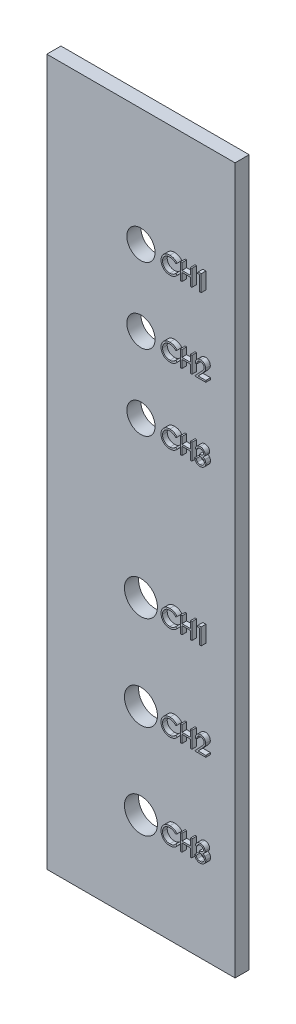
from build123d import *

# Parameters (mm, degrees)
SKETCH1_W           = 40
SKETCH1_H           = 150
SKETCH1_R           = 3
SKETCH1_R_2         = 3.5
BOSS_EXTRUDE1_DEPTH = 3
BOSS_EXTRUDE2_DEPTH = 1


with BuildPart() as part:
    # Sketch1 → Boss-Extrude1 (new body)
    with BuildSketch(Plane.XY):
        Rectangle(SKETCH1_W, SKETCH1_H)
        with Locations((0, 34)):
            Circle(SKETCH1_R, mode=Mode.SUBTRACT)
        with Locations((0, 50)):
            Circle(SKETCH1_R, mode=Mode.SUBTRACT)
        with Locations((0, 18)):
            Circle(SKETCH1_R, mode=Mode.SUBTRACT)
        with Locations((0, -55)):
            Circle(SKETCH1_R_2, mode=Mode.SUBTRACT)
        with Locations((0, -35)):
            Circle(SKETCH1_R_2, mode=Mode.SUBTRACT)
        with Locations((0, -15)):
            Circle(SKETCH1_R_2, mode=Mode.SUBTRACT)
    extrude(amount=BOSS_EXTRUDE1_DEPTH)

    # Sketch2 → Boss-Extrude2 (add)
    with BuildSketch(Plane.XY.offset(3)):
        with BuildLine():
            Line((8.679487179, 51.357772436), (8.404647436, 51.147435897))
            add(Edge.make_bspline(
                [(8.404647436, 51.147435897), (8.385041548, 51.170801867), (8.346094101, 51.217218783), (8.283434898, 51.282398327), (8.218133255, 51.343463589), (8.150214134, 51.400705469), (8.078455015, 51.452122234), (8.004594216, 51.500393337), (7.927396171, 51.543661075), (7.820644436, 51.596124061), (7.680996588, 51.650870216), (7.505201749, 51.696773448), (7.32169065, 51.725994623), (7.196493051, 51.729159465), (7.1328125, 51.730769231)],
                knots=[0, 0, 0, 0, 0.757959112, 1.505699292, 2.245454638, 2.979532153, 3.711538275, 4.438200793, 5.171680507, 5.909471876, 7.393775596, 8.890124382, 10.418191784, 12, 12, 12, 12], degree=3))
            add(Edge.make_bspline(
                [(7.1328125, 51.730769231), (7.097729201, 51.730365268), (7.027888208, 51.729561092), (6.924239735, 51.718951967), (6.822526683, 51.704040757), (6.722815217, 51.681915434), (6.625232259, 51.653942815), (6.529139857, 51.620517401), (6.435929257, 51.579162561), (6.344311019, 51.533454301), (6.256531808, 51.481826856), (6.17347676, 51.425513504), (6.095448792, 51.365144408), (6.02238618, 51.300493302), (5.954214231, 51.231851341), (5.891426921, 51.158487), (5.83424151, 51.080634826), (5.781524485, 50.999321419), (5.734311752, 50.914783627), (5.694781873, 50.826708556), (5.65977675, 50.736604453), (5.632077508, 50.643453293), (5.610152991, 50.547910527), (5.595025328, 50.449719739), (5.584536856, 50.349086059), (5.58373668, 50.280876747), (5.583333333, 50.246494391)],
                knots=[0, 0, 0, 0, 1.054917814, 2.100044995, 3.131103042, 4.146048494, 5.169673617, 6.183595914, 7.203665975, 8.234915748, 9.262203917, 10.264457458, 11.251630812, 12.227803204, 13.197192746, 14.159520551, 15.12972552, 16.100847026, 17.073214652, 18.039054194, 19.002613845, 19.979014051, 20.95965708, 21.949030935, 22.966165397, 24, 24, 24, 24], degree=3))
            add(Edge.make_bspline(
                [(5.583333333, 50.246494391), (5.584595152, 50.194763071), (5.587072567, 50.093195486), (5.609120901, 49.944424876), (5.642625992, 49.801904202), (5.692841569, 49.66652436), (5.75476062, 49.536616002), (5.833001231, 49.414377148), (5.923617768, 49.297960584), (6.027892188, 49.190117636), (6.142298004, 49.091603911), (6.265045915, 49.004853329), (6.395830203, 48.932538447), (6.533206833, 48.8723625), (6.678232947, 48.826105772), (6.83064775, 48.793541649), (6.990119745, 48.772299468), (7.099089145, 48.77026578), (7.154547276, 48.769230769)],
                knots=[0, 0, 0, 0, 1.029171465, 2.020641659, 2.987623507, 3.938342917, 4.889210282, 5.84687017, 6.821220943, 7.821438502, 8.827599549, 9.822697543, 10.807740252, 11.797342354, 12.80366471, 13.83203677, 14.896651826, 16, 16, 16, 16], degree=3))
            add(Edge.make_bspline(
                [(7.154547276, 48.769230769), (7.215649965, 48.770919549), (7.335914674, 48.774243472), (7.5122827, 48.802402721), (7.681118466, 48.848060638), (7.842431052, 48.911958561), (7.995765698, 48.995023849), (8.141362359, 49.095721726), (8.279343929, 49.215010059), (8.362315211, 49.306093187), (8.404647436, 49.352564103)],
                knots=[0, 0, 0, 0, 1.028121516, 2.023589091, 2.998037872, 3.967518031, 4.937445131, 5.927275754, 6.942489185, 8, 8, 8, 8], degree=3))
            Line((8.404647436, 49.352564103), (8.679487179, 49.144330929))
            add(Edge.make_bspline(
                [(8.679487179, 49.144330929), (8.65736907, 49.115792478), (8.613238794, 49.058852271), (8.541780777, 48.978580562), (8.46650348, 48.903076526), (8.38684777, 48.832948905), (8.303729978, 48.766794439), (8.215657666, 48.706492608), (8.123788634, 48.651201724), (8.028434155, 48.600574799), (7.929695542, 48.555657552), (7.827691107, 48.517203784), (7.722860531, 48.484078895), (7.615199023, 48.456826958), (7.504483266, 48.435555874), (7.391112792, 48.421336199), (7.274842917, 48.411594285), (7.196401496, 48.410706369), (7.156650641, 48.41025641)],
                knots=[0, 0, 0, 0, 0.986787822, 1.968848986, 2.935600012, 3.899624008, 4.868462664, 5.837806735, 6.815139263, 7.798259679, 8.787526145, 9.778297419, 10.776456485, 11.791383307, 12.812564526, 13.85620153, 14.913611965, 16, 16, 16, 16], degree=3))
            add(Edge.make_bspline(
                [(7.156650641, 48.41025641), (7.119006974, 48.410518403), (7.044571284, 48.411036461), (6.934672532, 48.419428628), (6.827682951, 48.430878365), (6.723908326, 48.448118496), (6.622782351, 48.468462836), (6.525221766, 48.495734093), (6.430266556, 48.526283259), (6.338298215, 48.562188246), (6.249238515, 48.602704429), (6.163374704, 48.648495987), (6.080746271, 48.699177852), (6.000540851, 48.753632863), (5.923943267, 48.813610164), (5.850289742, 48.878276799), (5.779167265, 48.94741481), (5.73516458, 48.997269663), (5.713040865, 49.022335737)],
                knots=[0, 0, 0, 0, 1.114604814, 2.203992996, 3.262667896, 4.300477797, 5.318619304, 6.316056647, 7.298880507, 8.271930387, 9.238335007, 10.195173496, 11.151986948, 12.108099108, 13.064862484, 14.031167946, 15.010108607, 16, 16, 16, 16], degree=3))
            add(Edge.make_bspline(
                [(5.713040865, 49.022335737), (5.677605222, 49.065876926), (5.607161745, 49.152433637), (5.517036062, 49.292719618), (5.439888506, 49.439187827), (5.377512586, 49.592607755), (5.328749852, 49.752635143), (5.294968657, 49.919350657), (5.273017053, 50.092598599), (5.270506764, 50.210435388), (5.269230769, 50.270332532)],
                knots=[0, 0, 0, 0, 0.994628077, 1.977248131, 2.950237994, 3.925870899, 4.908910175, 5.911660606, 6.938484602, 8, 8, 8, 8], degree=3))
            add(Edge.make_bspline(
                [(5.269230769, 50.270332532), (5.270785963, 50.333287986), (5.273845709, 50.45714891), (5.299841504, 50.638922863), (5.341660301, 50.813074262), (5.401057189, 50.979278007), (5.476362541, 51.138408287), (5.569389154, 51.289249492), (5.679056297, 51.432766292), (5.804503864, 51.566781043), (5.9420712, 51.689320396), (6.089390014, 51.797126599), (6.24617196, 51.886844115), (6.410689812, 51.961840278), (6.584175494, 52.019484741), (6.766258863, 52.059837928), (6.956597778, 52.084955044), (7.086460203, 52.088130252), (7.15244391, 52.08974359)],
                knots=[0, 0, 0, 0, 1.032925535, 2.032216505, 3.007276963, 3.968222605, 4.92396291, 5.891752235, 6.871517503, 7.883894988, 8.900124299, 9.891468569, 10.874487609, 11.85992873, 12.854644235, 13.869047385, 14.917252991, 16, 16, 16, 16], degree=3))
            add(Edge.make_bspline(
                [(7.15244391, 52.08974359), (7.192658382, 52.089261452), (7.272258879, 52.088307108), (7.390011532, 52.079000965), (7.504653859, 52.063487359), (7.616264841, 52.042371289), (7.725387457, 52.016163968), (7.831187698, 51.98202367), (7.934286385, 51.942987138), (8.034033293, 51.898028672), (8.129949843, 51.847561931), (8.222006162, 51.792146307), (8.30947102, 51.731850502), (8.392959869, 51.667187326), (8.47107608, 51.596788767), (8.546037558, 51.522591171), (8.615298637, 51.442457347), (8.658051832, 51.386052413), (8.679487179, 51.357772436)],
                knots=[0, 0, 0, 0, 1.096760587, 2.17092713, 3.219439832, 4.250915756, 5.268269357, 6.278326846, 7.281116186, 8.274029601, 9.260640565, 10.235837813, 11.203064059, 12.156899882, 13.114053108, 14.069676657, 15.032185724, 16, 16, 16, 16], degree=3))
        make_face()
        Polygon((9.397435897, 52), (9.711538462, 52), (9.711538462, 50.564102564), (11.506410256, 50.564102564), (11.506410256, 52), (11.820512821, 52), (11.820512821, 48.5), (11.506410256, 48.5), (11.506410256, 50.205128205), (9.711538462, 50.205128205), (9.711538462, 48.5), (9.397435897, 48.5), align=None)
        Polygon((13.147736378, 52), (13.794871795, 52), (13.794871795, 48.5), (13.480769231, 48.5), (13.480769231, 51.641025641), (12.942307692, 51.641025641), align=None)
        with BuildLine():
            Line((8.679487179, 35.357772436), (8.404647436, 35.147435897))
            add(Edge.make_bspline(
                [(8.404647436, 35.147435897), (8.385041548, 35.170801867), (8.346094101, 35.217218783), (8.283434898, 35.282398327), (8.218133255, 35.343463589), (8.150214134, 35.400705469), (8.078455015, 35.452122234), (8.004594216, 35.500393337), (7.927396171, 35.543661075), (7.820644436, 35.596124061), (7.680996588, 35.650870216), (7.505201749, 35.696773448), (7.32169065, 35.725994623), (7.196493051, 35.729159465), (7.1328125, 35.730769231)],
                knots=[0, 0, 0, 0, 0.757959112, 1.505699292, 2.245454638, 2.979532153, 3.711538275, 4.438200793, 5.171680507, 5.909471876, 7.393775596, 8.890124382, 10.418191784, 12, 12, 12, 12], degree=3))
            add(Edge.make_bspline(
                [(7.1328125, 35.730769231), (7.097729201, 35.730365268), (7.027888208, 35.729561092), (6.924239735, 35.718951967), (6.822526683, 35.704040757), (6.722815217, 35.681915434), (6.625232259, 35.653942815), (6.529139857, 35.620517401), (6.435929257, 35.579162561), (6.344311019, 35.533454301), (6.256531808, 35.481826856), (6.17347676, 35.425513504), (6.095448792, 35.365144408), (6.02238618, 35.300493302), (5.954214231, 35.231851341), (5.891426921, 35.158487), (5.83424151, 35.080634826), (5.781524485, 34.999321419), (5.734311752, 34.914783627), (5.694781873, 34.826708556), (5.65977675, 34.736604453), (5.632077508, 34.643453293), (5.610152991, 34.547910527), (5.595025328, 34.449719739), (5.584536856, 34.349086059), (5.58373668, 34.280876747), (5.583333333, 34.246494391)],
                knots=[0, 0, 0, 0, 1.054917814, 2.100044995, 3.131103042, 4.146048494, 5.169673617, 6.183595914, 7.203665975, 8.234915748, 9.262203917, 10.264457458, 11.251630812, 12.227803204, 13.197192746, 14.159520551, 15.12972552, 16.100847026, 17.073214652, 18.039054194, 19.002613845, 19.979014051, 20.95965708, 21.949030935, 22.966165397, 24, 24, 24, 24], degree=3))
            add(Edge.make_bspline(
                [(5.583333333, 34.246494391), (5.584595152, 34.194763071), (5.587072567, 34.093195486), (5.609120901, 33.944424876), (5.642625992, 33.801904202), (5.692841569, 33.66652436), (5.75476062, 33.536616002), (5.833001231, 33.414377148), (5.923617768, 33.297960584), (6.027892188, 33.190117636), (6.142298004, 33.091603911), (6.265045915, 33.004853329), (6.395830203, 32.932538447), (6.533206833, 32.8723625), (6.678232947, 32.826105772), (6.83064775, 32.793541649), (6.990119745, 32.772299468), (7.099089145, 32.77026578), (7.154547276, 32.769230769)],
                knots=[0, 0, 0, 0, 1.029171465, 2.020641659, 2.987623507, 3.938342917, 4.889210282, 5.84687017, 6.821220943, 7.821438502, 8.827599549, 9.822697543, 10.807740252, 11.797342354, 12.80366471, 13.83203677, 14.896651826, 16, 16, 16, 16], degree=3))
            add(Edge.make_bspline(
                [(7.154547276, 32.769230769), (7.215649965, 32.770919549), (7.335914674, 32.774243472), (7.5122827, 32.802402721), (7.681118466, 32.848060638), (7.842431052, 32.911958561), (7.995765698, 32.995023849), (8.141362359, 33.095721726), (8.279343929, 33.215010059), (8.362315211, 33.306093187), (8.404647436, 33.352564103)],
                knots=[0, 0, 0, 0, 1.028121516, 2.023589091, 2.998037872, 3.967518031, 4.937445131, 5.927275754, 6.942489185, 8, 8, 8, 8], degree=3))
            Line((8.404647436, 33.352564103), (8.679487179, 33.144330929))
            add(Edge.make_bspline(
                [(8.679487179, 33.144330929), (8.65736907, 33.115792478), (8.613238794, 33.058852271), (8.541780777, 32.978580562), (8.46650348, 32.903076526), (8.38684777, 32.832948905), (8.303729978, 32.766794439), (8.215657666, 32.706492608), (8.123788634, 32.651201724), (8.028434155, 32.600574799), (7.929695542, 32.555657552), (7.827691107, 32.517203784), (7.722860531, 32.484078895), (7.615199023, 32.456826958), (7.504483266, 32.435555874), (7.391112792, 32.421336199), (7.274842917, 32.411594285), (7.196401496, 32.410706369), (7.156650641, 32.41025641)],
                knots=[0, 0, 0, 0, 0.986787822, 1.968848986, 2.935600012, 3.899624008, 4.868462664, 5.837806735, 6.815139263, 7.798259679, 8.787526145, 9.778297419, 10.776456485, 11.791383307, 12.812564526, 13.85620153, 14.913611965, 16, 16, 16, 16], degree=3))
            add(Edge.make_bspline(
                [(7.156650641, 32.41025641), (7.119006974, 32.410518403), (7.044571284, 32.411036461), (6.934672532, 32.419428628), (6.827682951, 32.430878365), (6.723908326, 32.448118496), (6.622782351, 32.468462836), (6.525221766, 32.495734093), (6.430266556, 32.526283259), (6.338298215, 32.562188246), (6.249238515, 32.602704429), (6.163374704, 32.648495987), (6.080746271, 32.699177852), (6.000540851, 32.753632863), (5.923943267, 32.813610164), (5.850289742, 32.878276799), (5.779167265, 32.94741481), (5.73516458, 32.997269663), (5.713040865, 33.022335737)],
                knots=[0, 0, 0, 0, 1.114604814, 2.203992996, 3.262667896, 4.300477797, 5.318619304, 6.316056647, 7.298880507, 8.271930387, 9.238335007, 10.195173496, 11.151986948, 12.108099108, 13.064862484, 14.031167946, 15.010108607, 16, 16, 16, 16], degree=3))
            add(Edge.make_bspline(
                [(5.713040865, 33.022335737), (5.677605222, 33.065876926), (5.607161745, 33.152433637), (5.517036062, 33.292719618), (5.439888506, 33.439187827), (5.377512586, 33.592607755), (5.328749852, 33.752635143), (5.294968657, 33.919350657), (5.273017053, 34.092598599), (5.270506764, 34.210435388), (5.269230769, 34.270332532)],
                knots=[0, 0, 0, 0, 0.994628077, 1.977248131, 2.950237994, 3.925870899, 4.908910175, 5.911660606, 6.938484602, 8, 8, 8, 8], degree=3))
            add(Edge.make_bspline(
                [(5.269230769, 34.270332532), (5.270785963, 34.333287986), (5.273845709, 34.45714891), (5.299841504, 34.638922863), (5.341660301, 34.813074262), (5.401057189, 34.979278007), (5.476362541, 35.138408287), (5.569389154, 35.289249492), (5.679056297, 35.432766292), (5.804503864, 35.566781043), (5.9420712, 35.689320396), (6.089390014, 35.797126599), (6.24617196, 35.886844115), (6.410689812, 35.961840278), (6.584175494, 36.019484741), (6.766258863, 36.059837928), (6.956597778, 36.084955044), (7.086460203, 36.088130252), (7.15244391, 36.08974359)],
                knots=[0, 0, 0, 0, 1.032925535, 2.032216505, 3.007276963, 3.968222605, 4.92396291, 5.891752235, 6.871517503, 7.883894988, 8.900124299, 9.891468569, 10.874487609, 11.85992873, 12.854644235, 13.869047385, 14.917252991, 16, 16, 16, 16], degree=3))
            add(Edge.make_bspline(
                [(7.15244391, 36.08974359), (7.192658382, 36.089261452), (7.272258879, 36.088307108), (7.390011532, 36.079000965), (7.504653859, 36.063487359), (7.616264841, 36.042371289), (7.725387457, 36.016163968), (7.831187698, 35.98202367), (7.934286385, 35.942987138), (8.034033293, 35.898028672), (8.129949843, 35.847561931), (8.222006162, 35.792146307), (8.30947102, 35.731850502), (8.392959869, 35.667187326), (8.47107608, 35.596788767), (8.546037558, 35.522591171), (8.615298637, 35.442457347), (8.658051832, 35.386052413), (8.679487179, 35.357772436)],
                knots=[0, 0, 0, 0, 1.096760587, 2.17092713, 3.219439832, 4.250915756, 5.268269357, 6.278326846, 7.281116186, 8.274029601, 9.260640565, 10.235837813, 11.203064059, 12.156899882, 13.114053108, 14.069676657, 15.032185724, 16, 16, 16, 16], degree=3))
        make_face()
        Polygon((9.397435897, 36), (9.711538462, 36), (9.711538462, 34.564102564), (11.506410256, 34.564102564), (11.506410256, 36), (11.820512821, 36), (11.820512821, 32.5), (11.506410256, 32.5), (11.506410256, 34.205128205), (9.711538462, 34.205128205), (9.711538462, 32.5), (9.397435897, 32.5), align=None)
        with BuildLine():
            Line((12.852564103, 34.923076923), (12.538461538, 34.923076923))
            add(Edge.make_bspline(
                [(12.538461538, 34.923076923), (12.540508691, 34.964747811), (12.544529245, 35.046588325), (12.563357535, 35.165912232), (12.590298412, 35.279967031), (12.628389866, 35.387836945), (12.675696144, 35.490475752), (12.732426171, 35.587475767), (12.799620022, 35.678466956), (12.875826756, 35.762605799), (12.958595395, 35.83979337), (13.047901334, 35.906448613), (13.141746361, 35.962766284), (13.23984576, 36.009847526), (13.343306324, 36.045187372), (13.451189182, 36.071409012), (13.563968318, 36.087185357), (13.64080834, 36.088881143), (13.679887821, 36.08974359)],
                knots=[0, 0, 0, 0, 1.10065271, 2.161652631, 3.183658789, 4.190468796, 5.17591951, 6.163126047, 7.15150782, 8.156236427, 9.156009102, 10.134482811, 11.092018607, 12.041330605, 13.001268258, 13.972401359, 14.968799086, 16, 16, 16, 16], degree=3))
            add(Edge.make_bspline(
                [(13.679887821, 36.08974359), (13.718265895, 36.088845133), (13.793677439, 36.087079698), (13.903739454, 36.071918669), (14.008516748, 36.048173078), (14.107804515, 36.014857661), (14.200810579, 35.970073234), (14.288233624, 35.916275695), (14.371114435, 35.854055864), (14.445721218, 35.78080205), (14.514229297, 35.702599666), (14.573331553, 35.619111762), (14.623944716, 35.532882477), (14.666132396, 35.443254275), (14.697188535, 35.349383247), (14.720766743, 35.252636044), (14.734094157, 35.152011233), (14.73613958, 35.083904677), (14.737179487, 35.049278846)],
                knots=[0, 0, 0, 0, 1.111607364, 2.184268762, 3.212621178, 4.221274766, 5.211760367, 6.196651075, 7.1921475, 8.207485113, 9.220403448, 10.201281604, 11.166441695, 12.114753415, 13.065576456, 14.026450734, 14.996634279, 16, 16, 16, 16], degree=3))
            add(Edge.make_bspline(
                [(14.737179487, 35.049278846), (14.735486224, 35.000531012), (14.732129413, 34.903890798), (14.703415036, 34.761875935), (14.658568525, 34.624282516), (14.604571168, 34.513545214), (14.550098724, 34.42431172), (14.501011217, 34.350843015), (14.443546406, 34.271737547), (14.376867908, 34.18726021), (14.302355036, 34.096749304), (14.219332872, 34.000259509), (14.12720939, 33.898787739), (14.06255089, 33.829482138), (14.029046474, 33.793569712)],
                knots=[0, 0, 0, 0, 1.184426356, 2.348067706, 3.509069118, 4.696110526, 5.333549288, 6.050745305, 6.844228056, 7.710549037, 8.667450064, 9.695053472, 10.805634456, 12, 12, 12, 12], degree=3))
            Line((14.029046474, 33.793569712), (13.153345353, 32.858974359))
            Line((13.153345353, 32.858974359), (14.782051282, 32.858974359))
            Line((14.782051282, 32.858974359), (14.782051282, 32.5))
            Line((14.782051282, 32.5), (12.403846154, 32.5))
            Line((12.403846154, 32.5), (13.761217949, 33.948517628))
            add(Edge.make_bspline(
                [(13.761217949, 33.948517628), (13.794265836, 33.983015935), (13.857744063, 34.049280121), (13.947526639, 34.146023081), (14.028165628, 34.235772622), (14.100183021, 34.318359171), (14.162016526, 34.394990738), (14.216888758, 34.463185442), (14.260854349, 34.525939892), (14.308569745, 34.598680506), (14.354783726, 34.687492823), (14.394496082, 34.796026513), (14.41871093, 34.907753765), (14.421615766, 34.983255802), (14.423076923, 35.021233974)],
                knots=[0, 0, 0, 0, 1.329631726, 2.553950428, 3.673215718, 4.687767853, 5.603093632, 6.413772471, 7.123043292, 7.734684054, 8.834405432, 9.900288307, 10.943827018, 12, 12, 12, 12], degree=3))
            add(Edge.make_bspline(
                [(14.423076923, 35.021233974), (14.422441181, 35.045115373), (14.421188255, 35.092181023), (14.410130557, 35.161186782), (14.393420051, 35.227751596), (14.369474793, 35.292080215), (14.337868053, 35.353525867), (14.299394673, 35.412163347), (14.25500461, 35.468852313), (14.20365334, 35.522005611), (14.147241821, 35.570686816), (14.087647571, 35.613810902), (14.024597467, 35.649850012), (13.958357345, 35.679393509), (13.889111875, 35.702568891), (13.81672713, 35.71862747), (13.741403114, 35.728709954), (13.689969618, 35.730074126), (13.663762019, 35.730769231)],
                knots=[0, 0, 0, 0, 0.991446411, 1.95395049, 2.89581595, 3.838931463, 4.798493298, 5.75982156, 6.748411868, 7.785213223, 8.824556874, 9.840280684, 10.836137867, 11.835679398, 12.848801643, 13.863922112, 14.911575587, 16, 16, 16, 16], degree=3))
            add(Edge.make_bspline(
                [(13.663762019, 35.730769231), (13.636391186, 35.730054199), (13.58263939, 35.728649993), (13.503720357, 35.718827329), (13.42843458, 35.701881489), (13.356592677, 35.678704814), (13.288073091, 35.649246266), (13.223209047, 35.612554521), (13.162146158, 35.568771028), (13.104769634, 35.519130471), (13.051905655, 35.46386287), (13.005458779, 35.402252907), (12.964874765, 35.335425492), (12.929465532, 35.263560941), (12.900709842, 35.186007161), (12.878736691, 35.103039456), (12.861349845, 35.015018075), (12.855541324, 34.95423299), (12.852564103, 34.923076923)],
                knots=[0, 0, 0, 0, 1.031018746, 2.02475058, 2.990194455, 3.934040569, 4.864654155, 5.795059489, 6.735614925, 7.690564532, 8.649604399, 9.611025574, 10.590972636, 11.591080095, 12.624614302, 13.701020113, 14.821632451, 16, 16, 16, 16], degree=3))
        make_face()
        with BuildLine():
            Line((8.679487179, 19.357772436), (8.404647436, 19.147435897))
            add(Edge.make_bspline(
                [(8.404647436, 19.147435897), (8.385041548, 19.170801867), (8.346094101, 19.217218783), (8.283434898, 19.282398327), (8.218133255, 19.343463589), (8.150214134, 19.400705469), (8.078455015, 19.452122234), (8.004594216, 19.500393337), (7.927396171, 19.543661075), (7.820644436, 19.596124061), (7.680996588, 19.650870216), (7.505201749, 19.696773448), (7.32169065, 19.725994623), (7.196493051, 19.729159465), (7.1328125, 19.730769231)],
                knots=[0, 0, 0, 0, 0.757959112, 1.505699292, 2.245454638, 2.979532153, 3.711538275, 4.438200793, 5.171680507, 5.909471876, 7.393775596, 8.890124382, 10.418191784, 12, 12, 12, 12], degree=3))
            add(Edge.make_bspline(
                [(7.1328125, 19.730769231), (7.097729201, 19.730365268), (7.027888208, 19.729561092), (6.924239735, 19.718951967), (6.822526683, 19.704040757), (6.722815217, 19.681915434), (6.625232259, 19.653942815), (6.529139857, 19.620517401), (6.435929257, 19.579162561), (6.344311019, 19.533454301), (6.256531808, 19.481826856), (6.17347676, 19.425513504), (6.095448792, 19.365144408), (6.02238618, 19.300493302), (5.954214231, 19.231851341), (5.891426921, 19.158487), (5.83424151, 19.080634826), (5.781524485, 18.999321419), (5.734311752, 18.914783627), (5.694781873, 18.826708556), (5.65977675, 18.736604453), (5.632077508, 18.643453293), (5.610152991, 18.547910527), (5.595025328, 18.449719739), (5.584536856, 18.349086059), (5.58373668, 18.280876747), (5.583333333, 18.246494391)],
                knots=[0, 0, 0, 0, 1.054917814, 2.100044995, 3.131103042, 4.146048494, 5.169673617, 6.183595914, 7.203665975, 8.234915748, 9.262203917, 10.264457458, 11.251630812, 12.227803204, 13.197192746, 14.159520551, 15.12972552, 16.100847026, 17.073214652, 18.039054194, 19.002613845, 19.979014051, 20.95965708, 21.949030935, 22.966165397, 24, 24, 24, 24], degree=3))
            add(Edge.make_bspline(
                [(5.583333333, 18.246494391), (5.584595152, 18.194763071), (5.587072567, 18.093195486), (5.609120901, 17.944424876), (5.642625992, 17.801904202), (5.692841569, 17.66652436), (5.75476062, 17.536616002), (5.833001231, 17.414377148), (5.923617768, 17.297960584), (6.027892188, 17.190117636), (6.142298004, 17.091603911), (6.265045915, 17.004853329), (6.395830203, 16.932538447), (6.533206833, 16.8723625), (6.678232947, 16.826105772), (6.83064775, 16.793541649), (6.990119745, 16.772299468), (7.099089145, 16.77026578), (7.154547276, 16.769230769)],
                knots=[0, 0, 0, 0, 1.029171465, 2.020641659, 2.987623507, 3.938342917, 4.889210282, 5.84687017, 6.821220943, 7.821438502, 8.827599549, 9.822697543, 10.807740252, 11.797342354, 12.80366471, 13.83203677, 14.896651826, 16, 16, 16, 16], degree=3))
            add(Edge.make_bspline(
                [(7.154547276, 16.769230769), (7.215649965, 16.770919549), (7.335914674, 16.774243472), (7.5122827, 16.802402721), (7.681118466, 16.848060638), (7.842431052, 16.911958561), (7.995765698, 16.995023849), (8.141362359, 17.095721726), (8.279343929, 17.215010059), (8.362315211, 17.306093187), (8.404647436, 17.352564103)],
                knots=[0, 0, 0, 0, 1.028121516, 2.023589091, 2.998037872, 3.967518031, 4.937445131, 5.927275754, 6.942489185, 8, 8, 8, 8], degree=3))
            Line((8.404647436, 17.352564103), (8.679487179, 17.144330929))
            add(Edge.make_bspline(
                [(8.679487179, 17.144330929), (8.65736907, 17.115792478), (8.613238794, 17.058852271), (8.541780777, 16.978580562), (8.46650348, 16.903076526), (8.38684777, 16.832948905), (8.303729978, 16.766794439), (8.215657666, 16.706492608), (8.123788634, 16.651201724), (8.028434155, 16.600574799), (7.929695542, 16.555657552), (7.827691107, 16.517203784), (7.722860531, 16.484078895), (7.615199023, 16.456826958), (7.504483266, 16.435555874), (7.391112792, 16.421336199), (7.274842917, 16.411594285), (7.196401496, 16.410706369), (7.156650641, 16.41025641)],
                knots=[0, 0, 0, 0, 0.986787822, 1.968848986, 2.935600012, 3.899624008, 4.868462664, 5.837806735, 6.815139263, 7.798259679, 8.787526145, 9.778297419, 10.776456485, 11.791383307, 12.812564526, 13.85620153, 14.913611965, 16, 16, 16, 16], degree=3))
            add(Edge.make_bspline(
                [(7.156650641, 16.41025641), (7.119006974, 16.410518403), (7.044571284, 16.411036461), (6.934672532, 16.419428628), (6.827682951, 16.430878365), (6.723908326, 16.448118496), (6.622782351, 16.468462836), (6.525221766, 16.495734093), (6.430266556, 16.526283259), (6.338298215, 16.562188246), (6.249238515, 16.602704429), (6.163374704, 16.648495987), (6.080746271, 16.699177852), (6.000540851, 16.753632863), (5.923943267, 16.813610164), (5.850289742, 16.878276799), (5.779167265, 16.94741481), (5.73516458, 16.997269663), (5.713040865, 17.022335737)],
                knots=[0, 0, 0, 0, 1.114604814, 2.203992996, 3.262667896, 4.300477797, 5.318619304, 6.316056647, 7.298880507, 8.271930387, 9.238335007, 10.195173496, 11.151986948, 12.108099108, 13.064862484, 14.031167946, 15.010108607, 16, 16, 16, 16], degree=3))
            add(Edge.make_bspline(
                [(5.713040865, 17.022335737), (5.677605222, 17.065876926), (5.607161745, 17.152433637), (5.517036062, 17.292719618), (5.439888506, 17.439187827), (5.377512586, 17.592607755), (5.328749852, 17.752635143), (5.294968657, 17.919350657), (5.273017053, 18.092598599), (5.270506764, 18.210435388), (5.269230769, 18.270332532)],
                knots=[0, 0, 0, 0, 0.994628077, 1.977248131, 2.950237994, 3.925870899, 4.908910175, 5.911660606, 6.938484602, 8, 8, 8, 8], degree=3))
            add(Edge.make_bspline(
                [(5.269230769, 18.270332532), (5.270785963, 18.333287986), (5.273845709, 18.45714891), (5.299841504, 18.638922863), (5.341660301, 18.813074262), (5.401057189, 18.979278007), (5.476362541, 19.138408287), (5.569389154, 19.289249492), (5.679056297, 19.432766292), (5.804503864, 19.566781043), (5.9420712, 19.689320396), (6.089390014, 19.797126599), (6.24617196, 19.886844115), (6.410689812, 19.961840278), (6.584175494, 20.019484741), (6.766258863, 20.059837928), (6.956597778, 20.084955044), (7.086460203, 20.088130252), (7.15244391, 20.08974359)],
                knots=[0, 0, 0, 0, 1.032925535, 2.032216505, 3.007276963, 3.968222605, 4.92396291, 5.891752235, 6.871517503, 7.883894988, 8.900124299, 9.891468569, 10.874487609, 11.85992873, 12.854644235, 13.869047385, 14.917252991, 16, 16, 16, 16], degree=3))
            add(Edge.make_bspline(
                [(7.15244391, 20.08974359), (7.192658382, 20.089261452), (7.272258879, 20.088307108), (7.390011532, 20.079000965), (7.504653859, 20.063487359), (7.616264841, 20.042371289), (7.725387457, 20.016163968), (7.831187698, 19.98202367), (7.934286385, 19.942987138), (8.034033293, 19.898028672), (8.129949843, 19.847561931), (8.222006162, 19.792146307), (8.30947102, 19.731850502), (8.392959869, 19.667187326), (8.47107608, 19.596788767), (8.546037558, 19.522591171), (8.615298637, 19.442457347), (8.658051832, 19.386052413), (8.679487179, 19.357772436)],
                knots=[0, 0, 0, 0, 1.096760587, 2.17092713, 3.219439832, 4.250915756, 5.268269357, 6.278326846, 7.281116186, 8.274029601, 9.260640565, 10.235837813, 11.203064059, 12.156899882, 13.114053108, 14.069676657, 15.032185724, 16, 16, 16, 16], degree=3))
        make_face()
        Polygon((9.397435897, 20), (9.711538462, 20), (9.711538462, 18.564102564), (11.506410256, 18.564102564), (11.506410256, 20), (11.820512821, 20), (11.820512821, 16.5), (11.506410256, 16.5), (11.506410256, 18.205128205), (9.711538462, 18.205128205), (9.711538462, 16.5), (9.397435897, 16.5), align=None)
        with BuildLine():
            Line((12.852564103, 19.192307692), (12.538461538, 19.192307692))
            add(Edge.make_bspline(
                [(12.538461538, 19.192307692), (12.546971089, 19.227540176), (12.563606565, 19.296416801), (12.598304138, 19.394824062), (12.636103393, 19.487947583), (12.681492498, 19.574043657), (12.731001252, 19.654842559), (12.787723974, 19.728511684), (12.849043696, 19.796924649), (12.916868646, 19.857637887), (12.987997307, 19.912615616), (13.063431927, 19.959490673), (13.141654821, 19.999814826), (13.223207954, 20.033035058), (13.308334125, 20.058060582), (13.396263749, 20.076217387), (13.487227249, 20.088008502), (13.548974839, 20.089159265), (13.580328526, 20.08974359)],
                knots=[0, 0, 0, 0, 1.162005537, 2.271625781, 3.343758855, 4.383309926, 5.390229558, 6.379919256, 7.361854164, 8.333198761, 9.295911338, 10.242430842, 11.177959212, 12.116337295, 13.062827104, 14.020064771, 14.994644689, 16, 16, 16, 16], degree=3))
            add(Edge.make_bspline(
                [(13.580328526, 20.08974359), (13.626011268, 20.088364359), (13.716380279, 20.085635984), (13.849143326, 20.060721548), (13.977170145, 20.021296415), (14.099059393, 19.966822688), (14.212277825, 19.899635375), (14.313014012, 19.819670638), (14.399902523, 19.728471337), (14.4727969, 19.627738772), (14.529871899, 19.520083263), (14.571958273, 19.409283106), (14.597579954, 19.295601134), (14.600900511, 19.218843855), (14.602564103, 19.180388622)],
                knots=[0, 0, 0, 0, 1.083050992, 2.142477498, 3.193116406, 4.255571735, 5.30263384, 6.308962982, 7.297363603, 8.282367274, 9.249857812, 10.179914175, 11.08814088, 12, 12, 12, 12], degree=3))
            add(Edge.make_bspline(
                [(14.602564103, 19.180388622), (14.601400512, 19.143381827), (14.599123544, 19.070965273), (14.579789839, 18.965243775), (14.547253576, 18.865602175), (14.502183813, 18.771621013), (14.443842263, 18.683896173), (14.373169566, 18.602230282), (14.289666904, 18.526261124), (14.226387966, 18.482741651), (14.193810096, 18.460336538)],
                knots=[0, 0, 0, 0, 1.024540389, 2.004866551, 2.965041327, 3.920577974, 4.882998113, 5.874504559, 6.905732034, 8, 8, 8, 8], degree=3))
            add(Edge.make_bspline(
                [(14.193810096, 18.460336538), (14.231041851, 18.442358367), (14.304808725, 18.406738409), (14.405359255, 18.336882652), (14.49663713, 18.256226304), (14.547540849, 18.193283652), (14.573116987, 18.161658654)],
                knots=[0, 0, 0, 0, 1.015518401, 2.012035669, 3.001164323, 4, 4, 4, 4], degree=3))
            add(Edge.make_bspline(
                [(14.573116987, 18.161658654), (14.58995833, 18.138600902), (14.623365226, 18.092862986), (14.664600759, 18.01932656), (14.702009874, 17.944975071), (14.731160093, 17.867815664), (14.75373396, 17.788742651), (14.769869992, 17.707620255), (14.779894133, 17.624382232), (14.781329685, 17.568069752), (14.782051282, 17.539763622)],
                knots=[0, 0, 0, 0, 1.025084078, 2.033381695, 3.024893161, 4.013698104, 4.991890475, 5.976764909, 6.982997093, 8, 8, 8, 8], degree=3))
            add(Edge.make_bspline(
                [(14.782051282, 17.539763622), (14.780256769, 17.490753901), (14.776676187, 17.392965099), (14.744672112, 17.248490377), (14.695058872, 17.107264875), (14.624601936, 16.972190036), (14.538734427, 16.845809655), (14.436577103, 16.732733346), (14.319290694, 16.635534741), (14.188485045, 16.554324513), (14.046767917, 16.489406591), (13.895192325, 16.444349148), (13.735942271, 16.415003148), (13.626734973, 16.41185628), (13.571213942, 16.41025641)],
                knots=[0, 0, 0, 0, 0.955779014, 1.907060117, 2.875433937, 3.871313158, 4.872415639, 5.851225146, 6.836215519, 7.83643374, 8.849228613, 9.86973379, 10.916971861, 12, 12, 12, 12], degree=3))
            add(Edge.make_bspline(
                [(13.571213942, 16.41025641), (13.533794642, 16.411124624), (13.460165937, 16.412832978), (13.351922439, 16.424511579), (13.248600739, 16.445841584), (13.150061141, 16.474544889), (13.056216105, 16.510936632), (12.967352, 16.55625533), (12.882922106, 16.609566832), (12.803723155, 16.671500419), (12.729764587, 16.740781759), (12.663011863, 16.818640769), (12.60235207, 16.903638173), (12.549409432, 16.996761229), (12.501772479, 17.096806487), (12.462591522, 17.205054985), (12.428105954, 17.320539007), (12.412072489, 17.401016747), (12.403846154, 17.442307692)],
                knots=[0, 0, 0, 0, 1.048658725, 2.063410685, 3.046034179, 4.001477787, 4.936774919, 5.862367409, 6.792675028, 7.730719943, 8.675894397, 9.627829632, 10.600096036, 11.597688215, 12.626045268, 13.701542398, 14.82072376, 16, 16, 16, 16], degree=3))
            Line((12.403846154, 17.442307692), (12.717948718, 17.442307692))
            add(Edge.make_bspline(
                [(12.717948718, 17.442307692), (12.726132009, 17.415358679), (12.742049222, 17.362940507), (12.76914352, 17.287500202), (12.800011792, 17.218342149), (12.833126351, 17.154959027), (12.867904797, 17.096726624), (12.906819722, 17.045184755), (12.946988867, 16.998069553), (12.97726822, 16.971524941), (12.99208734, 16.958533654)],
                knots=[0, 0, 0, 0, 1.198163088, 2.33053128, 3.407730985, 4.417276592, 5.372219308, 6.28897303, 7.162600585, 8, 8, 8, 8], degree=3))
            add(Edge.make_bspline(
                [(12.99208734, 16.958533654), (13.011683916, 16.94342532), (13.050816579, 16.913255288), (13.11458481, 16.87475366), (13.181649696, 16.841392634), (13.253464371, 16.815908939), (13.328479141, 16.794331278), (13.407906506, 16.780210759), (13.491045723, 16.770522587), (13.547813487, 16.769667656), (13.576822917, 16.769230769)],
                knots=[0, 0, 0, 0, 0.946170439, 1.889420265, 2.845303464, 3.807233317, 4.801018734, 5.828864929, 6.890507805, 8, 8, 8, 8], degree=3))
            add(Edge.make_bspline(
                [(13.576822917, 16.769230769), (13.609576419, 16.769846674), (13.673623066, 16.771051024), (13.767077926, 16.782126731), (13.855985373, 16.798257144), (13.939358299, 16.823170127), (14.018288806, 16.853950979), (14.091670456, 16.892599384), (14.160466562, 16.937944106), (14.223795967, 16.989483264), (14.280741475, 17.045904759), (14.330880988, 17.10491783), (14.37350565, 17.16627366), (14.407889228, 17.230311781), (14.435039778, 17.29676701), (14.453522979, 17.365825839), (14.466374494, 17.436923105), (14.467421106, 17.485252074), (14.467948718, 17.509615385)],
                knots=[0, 0, 0, 0, 1.217147791, 2.380027433, 3.494444702, 4.572153297, 5.609568379, 6.639424714, 7.649109417, 8.668170816, 9.669597737, 10.625200337, 11.543417969, 12.441394052, 13.322311151, 14.205496177, 15.095365482, 16, 16, 16, 16], degree=3))
            add(Edge.make_bspline(
                [(14.467948718, 17.509615385), (14.466418416, 17.542226723), (14.463365428, 17.607287132), (14.440056848, 17.703004706), (14.401717984, 17.795228118), (14.348045473, 17.882383909), (14.282709744, 17.96315981), (14.206344837, 18.035231293), (14.118316609, 18.094701384), (14.03729674, 18.13579004), (13.965531584, 18.163827115), (13.904116199, 18.18250208), (13.835359596, 18.198315735), (13.760093247, 18.213028007), (13.67775003, 18.225549355), (13.588419592, 18.235991171), (13.492083831, 18.244346212), (13.425392665, 18.248077307), (13.391025641, 18.25)],
                knots=[0, 0, 0, 0, 1.07054697, 2.135767047, 3.216561865, 4.33974944, 5.486079747, 6.621378074, 7.775625952, 8.963672916, 9.598146892, 10.304877434, 11.070270905, 11.915000392, 12.823868403, 13.805723172, 14.86925407, 16, 16, 16, 16], degree=3))
            Line((13.391025641, 18.25), (13.391025641, 18.608974359))
            add(Edge.make_bspline(
                [(13.391025641, 18.608974359), (13.434326807, 18.609709163), (13.519143153, 18.611148463), (13.643037458, 18.628556473), (13.76151077, 18.652637101), (13.871937512, 18.689522293), (13.972586226, 18.73236259), (14.059905828, 18.7822148), (14.132672975, 18.837629549), (14.190534046, 18.899462158), (14.234063275, 18.965777206), (14.265890072, 19.034893864), (14.284690399, 19.107417924), (14.287200066, 19.156912592), (14.288461538, 19.181790865)],
                knots=[0, 0, 0, 0, 1.321986639, 2.589447074, 3.816329219, 5.01088745, 6.139805852, 7.153945165, 8.075214402, 8.924034688, 9.728124013, 10.488707548, 11.240355623, 12, 12, 12, 12], degree=3))
            add(Edge.make_bspline(
                [(14.288461538, 19.181790865), (14.288047127, 19.200068611), (14.287222677, 19.236431318), (14.276825399, 19.289556386), (14.261201358, 19.341057332), (14.239721628, 19.390715142), (14.21097143, 19.438185416), (14.176565443, 19.483872865), (14.135597343, 19.527516644), (14.088651896, 19.568196964), (14.038240091, 19.606966201), (13.982990316, 19.639879838), (13.924568441, 19.6680249), (13.862909786, 19.691234402), (13.797814256, 19.70869369), (13.729587698, 19.721229532), (13.658100015, 19.729067187), (13.609328283, 19.730195602), (13.584535256, 19.730769231)],
                knots=[0, 0, 0, 0, 0.884392785, 1.759457502, 2.611959086, 3.489218968, 4.37281399, 5.2945488, 6.255912374, 7.266815255, 8.301784654, 9.332968512, 10.37626691, 11.440494194, 12.520033166, 13.637162961, 14.798855837, 16, 16, 16, 16], degree=3))
            add(Edge.make_bspline(
                [(13.584535256, 19.730769231), (13.544683588, 19.729377869), (13.466844012, 19.726660215), (13.354629095, 19.702857202), (13.250309761, 19.664879118), (13.170571095, 19.619546099), (13.11168852, 19.574795665), (13.069611582, 19.535713279), (13.028291072, 19.492280455), (12.990445395, 19.44182208), (12.952171418, 19.387755289), (12.917326857, 19.327331608), (12.883467164, 19.262127214), (12.863064615, 19.216031579), (12.852564103, 19.192307692)],
                knots=[0, 0, 0, 0, 1.472543308, 2.876219568, 4.221790263, 5.565193594, 6.249813518, 6.953379497, 7.687249741, 8.463570142, 9.283606569, 10.136032583, 11.040678096, 12, 12, 12, 12], degree=3))
        make_face()
        with BuildLine():
            Line((8.679487179, -13.642227564), (8.404647436, -13.852564103))
            add(Edge.make_bspline(
                [(8.404647436, -13.852564103), (8.385041548, -13.829198133), (8.346094101, -13.782781217), (8.283434898, -13.717601673), (8.218133255, -13.656536411), (8.150214134, -13.599294531), (8.078455015, -13.547877766), (8.004594216, -13.499606663), (7.927396171, -13.456338925), (7.820644436, -13.403875939), (7.680996588, -13.349129784), (7.505201749, -13.303226552), (7.32169065, -13.274005377), (7.196493051, -13.270840535), (7.1328125, -13.269230769)],
                knots=[0, 0, 0, 0, 0.757959112, 1.505699292, 2.245454638, 2.979532153, 3.711538275, 4.438200793, 5.171680507, 5.909471876, 7.393775596, 8.890124382, 10.418191784, 12, 12, 12, 12], degree=3))
            add(Edge.make_bspline(
                [(7.1328125, -13.269230769), (7.097729201, -13.269634732), (7.027888208, -13.270438908), (6.924239735, -13.281048033), (6.822526683, -13.295959243), (6.722815217, -13.318084566), (6.625232259, -13.346057185), (6.529139857, -13.379482599), (6.435929257, -13.420837439), (6.344311019, -13.466545699), (6.256531808, -13.518173144), (6.17347676, -13.574486496), (6.095448792, -13.634855592), (6.02238618, -13.699506698), (5.954214231, -13.768148659), (5.891426921, -13.841513), (5.83424151, -13.919365174), (5.781524485, -14.000678581), (5.734311752, -14.085216373), (5.694781873, -14.173291444), (5.65977675, -14.263395547), (5.632077508, -14.356546707), (5.610152991, -14.452089473), (5.595025328, -14.550280261), (5.584536856, -14.650913941), (5.58373668, -14.719123253), (5.583333333, -14.753505609)],
                knots=[0, 0, 0, 0, 1.054917814, 2.100044995, 3.131103042, 4.146048494, 5.169673617, 6.183595914, 7.203665975, 8.234915748, 9.262203917, 10.264457458, 11.251630812, 12.227803204, 13.197192746, 14.159520551, 15.12972552, 16.100847026, 17.073214652, 18.039054194, 19.002613845, 19.979014051, 20.95965708, 21.949030935, 22.966165397, 24, 24, 24, 24], degree=3))
            add(Edge.make_bspline(
                [(5.583333333, -14.753505609), (5.584595152, -14.805236929), (5.587072567, -14.906804514), (5.609120901, -15.055575124), (5.642625992, -15.198095798), (5.692841569, -15.33347564), (5.75476062, -15.463383998), (5.833001231, -15.585622852), (5.923617768, -15.702039416), (6.027892188, -15.809882364), (6.142298004, -15.908396089), (6.265045915, -15.995146671), (6.395830203, -16.067461553), (6.533206833, -16.1276375), (6.678232947, -16.173894228), (6.83064775, -16.206458351), (6.990119745, -16.227700532), (7.099089145, -16.22973422), (7.154547276, -16.230769231)],
                knots=[0, 0, 0, 0, 1.029171465, 2.020641659, 2.987623507, 3.938342917, 4.889210282, 5.84687017, 6.821220943, 7.821438502, 8.827599549, 9.822697543, 10.807740252, 11.797342354, 12.80366471, 13.83203677, 14.896651826, 16, 16, 16, 16], degree=3))
            add(Edge.make_bspline(
                [(7.154547276, -16.230769231), (7.215649965, -16.229080451), (7.335914674, -16.225756528), (7.5122827, -16.197597279), (7.681118466, -16.151939362), (7.842431052, -16.088041439), (7.995765698, -16.004976151), (8.141362359, -15.904278274), (8.279343929, -15.784989941), (8.362315211, -15.693906813), (8.404647436, -15.647435897)],
                knots=[0, 0, 0, 0, 1.028121516, 2.023589091, 2.998037872, 3.967518031, 4.937445131, 5.927275754, 6.942489185, 8, 8, 8, 8], degree=3))
            Line((8.404647436, -15.647435897), (8.679487179, -15.855669071))
            add(Edge.make_bspline(
                [(8.679487179, -15.855669071), (8.65736907, -15.884207522), (8.613238794, -15.941147729), (8.541780777, -16.021419438), (8.46650348, -16.096923474), (8.38684777, -16.167051095), (8.303729978, -16.233205561), (8.215657666, -16.293507392), (8.123788634, -16.348798276), (8.028434155, -16.399425201), (7.929695542, -16.444342448), (7.827691107, -16.482796216), (7.722860531, -16.515921105), (7.615199023, -16.543173042), (7.504483266, -16.564444126), (7.391112792, -16.578663801), (7.274842917, -16.588405715), (7.196401496, -16.589293631), (7.156650641, -16.58974359)],
                knots=[0, 0, 0, 0, 0.986787822, 1.968848986, 2.935600012, 3.899624008, 4.868462664, 5.837806735, 6.815139263, 7.798259679, 8.787526145, 9.778297419, 10.776456485, 11.791383307, 12.812564526, 13.85620153, 14.913611965, 16, 16, 16, 16], degree=3))
            add(Edge.make_bspline(
                [(7.156650641, -16.58974359), (7.119006974, -16.589481597), (7.044571284, -16.588963539), (6.934672532, -16.580571372), (6.827682951, -16.569121635), (6.723908326, -16.551881504), (6.622782351, -16.531537164), (6.525221766, -16.504265907), (6.430266556, -16.473716741), (6.338298215, -16.437811754), (6.249238515, -16.397295571), (6.163374704, -16.351504013), (6.080746271, -16.300822148), (6.000540851, -16.246367137), (5.923943267, -16.186389836), (5.850289742, -16.121723201), (5.779167265, -16.05258519), (5.73516458, -16.002730337), (5.713040865, -15.977664263)],
                knots=[0, 0, 0, 0, 1.114604814, 2.203992996, 3.262667896, 4.300477797, 5.318619304, 6.316056647, 7.298880507, 8.271930387, 9.238335007, 10.195173496, 11.151986948, 12.108099108, 13.064862484, 14.031167946, 15.010108607, 16, 16, 16, 16], degree=3))
            add(Edge.make_bspline(
                [(5.713040865, -15.977664263), (5.677605222, -15.934123074), (5.607161745, -15.847566363), (5.517036062, -15.707280382), (5.439888506, -15.560812173), (5.377512586, -15.407392245), (5.328749852, -15.247364857), (5.294968657, -15.080649343), (5.273017053, -14.907401401), (5.270506764, -14.789564612), (5.269230769, -14.729667468)],
                knots=[0, 0, 0, 0, 0.994628077, 1.977248131, 2.950237994, 3.925870899, 4.908910175, 5.911660606, 6.938484602, 8, 8, 8, 8], degree=3))
            add(Edge.make_bspline(
                [(5.269230769, -14.729667468), (5.270785963, -14.666712014), (5.273845709, -14.54285109), (5.299841504, -14.361077137), (5.341660301, -14.186925738), (5.401057189, -14.020721993), (5.476362541, -13.861591713), (5.569389154, -13.710750508), (5.679056297, -13.567233708), (5.804503864, -13.433218957), (5.9420712, -13.310679604), (6.089390014, -13.202873401), (6.24617196, -13.113155885), (6.410689812, -13.038159722), (6.584175494, -12.980515259), (6.766258863, -12.940162072), (6.956597778, -12.915044956), (7.086460203, -12.911869748), (7.15244391, -12.91025641)],
                knots=[0, 0, 0, 0, 1.032925535, 2.032216505, 3.007276963, 3.968222605, 4.92396291, 5.891752235, 6.871517503, 7.883894988, 8.900124299, 9.891468569, 10.874487609, 11.85992873, 12.854644235, 13.869047385, 14.917252991, 16, 16, 16, 16], degree=3))
            add(Edge.make_bspline(
                [(7.15244391, -12.91025641), (7.192658382, -12.910738548), (7.272258879, -12.911692892), (7.390011532, -12.920999035), (7.504653859, -12.936512641), (7.616264841, -12.957628711), (7.725387457, -12.983836032), (7.831187698, -13.01797633), (7.934286385, -13.057012862), (8.034033293, -13.101971328), (8.129949843, -13.152438069), (8.222006162, -13.207853693), (8.30947102, -13.268149498), (8.392959869, -13.332812674), (8.47107608, -13.403211233), (8.546037558, -13.477408829), (8.615298637, -13.557542653), (8.658051832, -13.613947587), (8.679487179, -13.642227564)],
                knots=[0, 0, 0, 0, 1.096760587, 2.17092713, 3.219439832, 4.250915756, 5.268269357, 6.278326846, 7.281116186, 8.274029601, 9.260640565, 10.235837813, 11.203064059, 12.156899882, 13.114053108, 14.069676657, 15.032185724, 16, 16, 16, 16], degree=3))
        make_face()
        Polygon((9.397435897, -13), (9.711538462, -13), (9.711538462, -14.435897436), (11.506410256, -14.435897436), (11.506410256, -13), (11.820512821, -13), (11.820512821, -16.5), (11.506410256, -16.5), (11.506410256, -14.794871795), (9.711538462, -14.794871795), (9.711538462, -16.5), (9.397435897, -16.5), align=None)
        Polygon((13.147736378, -13), (13.794871795, -13), (13.794871795, -16.5), (13.480769231, -16.5), (13.480769231, -13.358974359), (12.942307692, -13.358974359), align=None)
        with BuildLine():
            Line((8.679487179, -33.642227564), (8.404647436, -33.852564103))
            add(Edge.make_bspline(
                [(8.404647436, -33.852564103), (8.385041548, -33.829198133), (8.346094101, -33.782781217), (8.283434898, -33.717601673), (8.218133255, -33.656536411), (8.150214134, -33.599294531), (8.078455015, -33.547877766), (8.004594216, -33.499606663), (7.927396171, -33.456338925), (7.820644436, -33.403875939), (7.680996588, -33.349129784), (7.505201749, -33.303226552), (7.32169065, -33.274005377), (7.196493051, -33.270840535), (7.1328125, -33.269230769)],
                knots=[0, 0, 0, 0, 0.757959112, 1.505699292, 2.245454638, 2.979532153, 3.711538275, 4.438200793, 5.171680507, 5.909471876, 7.393775596, 8.890124382, 10.418191784, 12, 12, 12, 12], degree=3))
            add(Edge.make_bspline(
                [(7.1328125, -33.269230769), (7.097729201, -33.269634732), (7.027888208, -33.270438908), (6.924239735, -33.281048033), (6.822526683, -33.295959243), (6.722815217, -33.318084566), (6.625232259, -33.346057185), (6.529139857, -33.379482599), (6.435929257, -33.420837439), (6.344311019, -33.466545699), (6.256531808, -33.518173144), (6.17347676, -33.574486496), (6.095448792, -33.634855592), (6.02238618, -33.699506698), (5.954214231, -33.768148659), (5.891426921, -33.841513), (5.83424151, -33.919365174), (5.781524485, -34.000678581), (5.734311752, -34.085216373), (5.694781873, -34.173291444), (5.65977675, -34.263395547), (5.632077508, -34.356546707), (5.610152991, -34.452089473), (5.595025328, -34.550280261), (5.584536856, -34.650913941), (5.58373668, -34.719123253), (5.583333333, -34.753505609)],
                knots=[0, 0, 0, 0, 1.054917814, 2.100044995, 3.131103042, 4.146048494, 5.169673617, 6.183595914, 7.203665975, 8.234915748, 9.262203917, 10.264457458, 11.251630812, 12.227803204, 13.197192746, 14.159520551, 15.12972552, 16.100847026, 17.073214652, 18.039054194, 19.002613845, 19.979014051, 20.95965708, 21.949030935, 22.966165397, 24, 24, 24, 24], degree=3))
            add(Edge.make_bspline(
                [(5.583333333, -34.753505609), (5.584595152, -34.805236929), (5.587072567, -34.906804514), (5.609120901, -35.055575124), (5.642625992, -35.198095798), (5.692841569, -35.33347564), (5.75476062, -35.463383998), (5.833001231, -35.585622852), (5.923617768, -35.702039416), (6.027892188, -35.809882364), (6.142298004, -35.908396089), (6.265045915, -35.995146671), (6.395830203, -36.067461553), (6.533206833, -36.1276375), (6.678232947, -36.173894228), (6.83064775, -36.206458351), (6.990119745, -36.227700532), (7.099089145, -36.22973422), (7.154547276, -36.230769231)],
                knots=[0, 0, 0, 0, 1.029171465, 2.020641659, 2.987623507, 3.938342917, 4.889210282, 5.84687017, 6.821220943, 7.821438502, 8.827599549, 9.822697543, 10.807740252, 11.797342354, 12.80366471, 13.83203677, 14.896651826, 16, 16, 16, 16], degree=3))
            add(Edge.make_bspline(
                [(7.154547276, -36.230769231), (7.215649965, -36.229080451), (7.335914674, -36.225756528), (7.5122827, -36.197597279), (7.681118466, -36.151939362), (7.842431052, -36.088041439), (7.995765698, -36.004976151), (8.141362359, -35.904278274), (8.279343929, -35.784989941), (8.362315211, -35.693906813), (8.404647436, -35.647435897)],
                knots=[0, 0, 0, 0, 1.028121516, 2.023589091, 2.998037872, 3.967518031, 4.937445131, 5.927275754, 6.942489185, 8, 8, 8, 8], degree=3))
            Line((8.404647436, -35.647435897), (8.679487179, -35.855669071))
            add(Edge.make_bspline(
                [(8.679487179, -35.855669071), (8.65736907, -35.884207522), (8.613238794, -35.941147729), (8.541780777, -36.021419438), (8.46650348, -36.096923474), (8.38684777, -36.167051095), (8.303729978, -36.233205561), (8.215657666, -36.293507392), (8.123788634, -36.348798276), (8.028434155, -36.399425201), (7.929695542, -36.444342448), (7.827691107, -36.482796216), (7.722860531, -36.515921105), (7.615199023, -36.543173042), (7.504483266, -36.564444126), (7.391112792, -36.578663801), (7.274842917, -36.588405715), (7.196401496, -36.589293631), (7.156650641, -36.58974359)],
                knots=[0, 0, 0, 0, 0.986787822, 1.968848986, 2.935600012, 3.899624008, 4.868462664, 5.837806735, 6.815139263, 7.798259679, 8.787526145, 9.778297419, 10.776456485, 11.791383307, 12.812564526, 13.85620153, 14.913611965, 16, 16, 16, 16], degree=3))
            add(Edge.make_bspline(
                [(7.156650641, -36.58974359), (7.119006974, -36.589481597), (7.044571284, -36.588963539), (6.934672532, -36.580571372), (6.827682951, -36.569121635), (6.723908326, -36.551881504), (6.622782351, -36.531537164), (6.525221766, -36.504265907), (6.430266556, -36.473716741), (6.338298215, -36.437811754), (6.249238515, -36.397295571), (6.163374704, -36.351504013), (6.080746271, -36.300822148), (6.000540851, -36.246367137), (5.923943267, -36.186389836), (5.850289742, -36.121723201), (5.779167265, -36.05258519), (5.73516458, -36.002730337), (5.713040865, -35.977664263)],
                knots=[0, 0, 0, 0, 1.114604814, 2.203992996, 3.262667896, 4.300477797, 5.318619304, 6.316056647, 7.298880507, 8.271930387, 9.238335007, 10.195173496, 11.151986948, 12.108099108, 13.064862484, 14.031167946, 15.010108607, 16, 16, 16, 16], degree=3))
            add(Edge.make_bspline(
                [(5.713040865, -35.977664263), (5.677605222, -35.934123074), (5.607161745, -35.847566363), (5.517036062, -35.707280382), (5.439888506, -35.560812173), (5.377512586, -35.407392245), (5.328749852, -35.247364857), (5.294968657, -35.080649343), (5.273017053, -34.907401401), (5.270506764, -34.789564612), (5.269230769, -34.729667468)],
                knots=[0, 0, 0, 0, 0.994628077, 1.977248131, 2.950237994, 3.925870899, 4.908910175, 5.911660606, 6.938484602, 8, 8, 8, 8], degree=3))
            add(Edge.make_bspline(
                [(5.269230769, -34.729667468), (5.270785963, -34.666712014), (5.273845709, -34.54285109), (5.299841504, -34.361077137), (5.341660301, -34.186925738), (5.401057189, -34.020721993), (5.476362541, -33.861591713), (5.569389154, -33.710750508), (5.679056297, -33.567233708), (5.804503864, -33.433218957), (5.9420712, -33.310679604), (6.089390014, -33.202873401), (6.24617196, -33.113155885), (6.410689812, -33.038159722), (6.584175494, -32.980515259), (6.766258863, -32.940162072), (6.956597778, -32.915044956), (7.086460203, -32.911869748), (7.15244391, -32.91025641)],
                knots=[0, 0, 0, 0, 1.032925535, 2.032216505, 3.007276963, 3.968222605, 4.92396291, 5.891752235, 6.871517503, 7.883894988, 8.900124299, 9.891468569, 10.874487609, 11.85992873, 12.854644235, 13.869047385, 14.917252991, 16, 16, 16, 16], degree=3))
            add(Edge.make_bspline(
                [(7.15244391, -32.91025641), (7.192658382, -32.910738548), (7.272258879, -32.911692892), (7.390011532, -32.920999035), (7.504653859, -32.936512641), (7.616264841, -32.957628711), (7.725387457, -32.983836032), (7.831187698, -33.01797633), (7.934286385, -33.057012862), (8.034033293, -33.101971328), (8.129949843, -33.152438069), (8.222006162, -33.207853693), (8.30947102, -33.268149498), (8.392959869, -33.332812674), (8.47107608, -33.403211233), (8.546037558, -33.477408829), (8.615298637, -33.557542653), (8.658051832, -33.613947587), (8.679487179, -33.642227564)],
                knots=[0, 0, 0, 0, 1.096760587, 2.17092713, 3.219439832, 4.250915756, 5.268269357, 6.278326846, 7.281116186, 8.274029601, 9.260640565, 10.235837813, 11.203064059, 12.156899882, 13.114053108, 14.069676657, 15.032185724, 16, 16, 16, 16], degree=3))
        make_face()
        Polygon((9.397435897, -33), (9.711538462, -33), (9.711538462, -34.435897436), (11.506410256, -34.435897436), (11.506410256, -33), (11.820512821, -33), (11.820512821, -36.5), (11.506410256, -36.5), (11.506410256, -34.794871795), (9.711538462, -34.794871795), (9.711538462, -36.5), (9.397435897, -36.5), align=None)
        with BuildLine():
            Line((12.852564103, -34.076923077), (12.538461538, -34.076923077))
            add(Edge.make_bspline(
                [(12.538461538, -34.076923077), (12.540508691, -34.035252189), (12.544529245, -33.953411675), (12.563357535, -33.834087768), (12.590298412, -33.720032969), (12.628389866, -33.612163055), (12.675696144, -33.509524248), (12.732426171, -33.412524233), (12.799620022, -33.321533044), (12.875826756, -33.237394201), (12.958595395, -33.16020663), (13.047901334, -33.093551387), (13.141746361, -33.037233716), (13.23984576, -32.990152474), (13.343306324, -32.954812628), (13.451189182, -32.928590988), (13.563968318, -32.912814643), (13.64080834, -32.911118857), (13.679887821, -32.91025641)],
                knots=[0, 0, 0, 0, 1.10065271, 2.161652631, 3.183658789, 4.190468796, 5.17591951, 6.163126047, 7.15150782, 8.156236427, 9.156009102, 10.134482811, 11.092018607, 12.041330605, 13.001268258, 13.972401359, 14.968799086, 16, 16, 16, 16], degree=3))
            add(Edge.make_bspline(
                [(13.679887821, -32.91025641), (13.718265895, -32.911154867), (13.793677439, -32.912920302), (13.903739454, -32.928081331), (14.008516748, -32.951826922), (14.107804515, -32.985142339), (14.200810579, -33.029926766), (14.288233624, -33.083724305), (14.371114435, -33.145944136), (14.445721218, -33.21919795), (14.514229297, -33.297400334), (14.573331553, -33.380888238), (14.623944716, -33.467117523), (14.666132396, -33.556745725), (14.697188535, -33.650616753), (14.720766743, -33.747363956), (14.734094157, -33.847988767), (14.73613958, -33.916095323), (14.737179487, -33.950721154)],
                knots=[0, 0, 0, 0, 1.111607364, 2.184268762, 3.212621178, 4.221274766, 5.211760367, 6.196651075, 7.1921475, 8.207485113, 9.220403448, 10.201281604, 11.166441695, 12.114753415, 13.065576456, 14.026450734, 14.996634279, 16, 16, 16, 16], degree=3))
            add(Edge.make_bspline(
                [(14.737179487, -33.950721154), (14.735486224, -33.999468988), (14.732129413, -34.096109202), (14.703415036, -34.238124065), (14.658568525, -34.375717484), (14.604571168, -34.486454786), (14.550098724, -34.57568828), (14.501011217, -34.649156985), (14.443546406, -34.728262453), (14.376867908, -34.81273979), (14.302355036, -34.903250696), (14.219332872, -34.999740491), (14.12720939, -35.101212261), (14.06255089, -35.170517862), (14.029046474, -35.206430288)],
                knots=[0, 0, 0, 0, 1.184426356, 2.348067706, 3.509069118, 4.696110526, 5.333549288, 6.050745305, 6.844228056, 7.710549037, 8.667450064, 9.695053472, 10.805634456, 12, 12, 12, 12], degree=3))
            Line((14.029046474, -35.206430288), (13.153345353, -36.141025641))
            Line((13.153345353, -36.141025641), (14.782051282, -36.141025641))
            Line((14.782051282, -36.141025641), (14.782051282, -36.5))
            Line((14.782051282, -36.5), (12.403846154, -36.5))
            Line((12.403846154, -36.5), (13.761217949, -35.051482372))
            add(Edge.make_bspline(
                [(13.761217949, -35.051482372), (13.794265836, -35.016984065), (13.857744063, -34.950719879), (13.947526639, -34.853976919), (14.028165628, -34.764227378), (14.100183021, -34.681640829), (14.162016526, -34.605009262), (14.216888758, -34.536814558), (14.260854349, -34.474060108), (14.308569745, -34.401319494), (14.354783726, -34.312507177), (14.394496082, -34.203973487), (14.41871093, -34.092246235), (14.421615766, -34.016744198), (14.423076923, -33.978766026)],
                knots=[0, 0, 0, 0, 1.329631726, 2.553950428, 3.673215718, 4.687767853, 5.603093632, 6.413772471, 7.123043292, 7.734684054, 8.834405432, 9.900288307, 10.943827018, 12, 12, 12, 12], degree=3))
            add(Edge.make_bspline(
                [(14.423076923, -33.978766026), (14.422441181, -33.954884627), (14.421188255, -33.907818977), (14.410130557, -33.838813218), (14.393420051, -33.772248404), (14.369474793, -33.707919785), (14.337868053, -33.646474133), (14.299394673, -33.587836653), (14.25500461, -33.531147687), (14.20365334, -33.477994389), (14.147241821, -33.429313184), (14.087647571, -33.386189098), (14.024597467, -33.350149988), (13.958357345, -33.320606491), (13.889111875, -33.297431109), (13.81672713, -33.28137253), (13.741403114, -33.271290046), (13.689969618, -33.269925874), (13.663762019, -33.269230769)],
                knots=[0, 0, 0, 0, 0.991446411, 1.95395049, 2.89581595, 3.838931463, 4.798493298, 5.75982156, 6.748411868, 7.785213223, 8.824556874, 9.840280684, 10.836137867, 11.835679398, 12.848801643, 13.863922112, 14.911575587, 16, 16, 16, 16], degree=3))
            add(Edge.make_bspline(
                [(13.663762019, -33.269230769), (13.636391186, -33.269945801), (13.58263939, -33.271350007), (13.503720357, -33.281172671), (13.42843458, -33.298118511), (13.356592677, -33.321295186), (13.288073091, -33.350753734), (13.223209047, -33.387445479), (13.162146158, -33.431228972), (13.104769634, -33.480869529), (13.051905655, -33.53613713), (13.005458779, -33.597747093), (12.964874765, -33.664574508), (12.929465532, -33.736439059), (12.900709842, -33.813992839), (12.878736691, -33.896960544), (12.861349845, -33.984981925), (12.855541324, -34.04576701), (12.852564103, -34.076923077)],
                knots=[0, 0, 0, 0, 1.031018746, 2.02475058, 2.990194455, 3.934040569, 4.864654155, 5.795059489, 6.735614925, 7.690564532, 8.649604399, 9.611025574, 10.590972636, 11.591080095, 12.624614302, 13.701020113, 14.821632451, 16, 16, 16, 16], degree=3))
        make_face()
        with BuildLine():
            Line((8.679487179, -53.642227564), (8.404647436, -53.852564103))
            add(Edge.make_bspline(
                [(8.404647436, -53.852564103), (8.385041548, -53.829198133), (8.346094101, -53.782781217), (8.283434898, -53.717601673), (8.218133255, -53.656536411), (8.150214134, -53.599294531), (8.078455015, -53.547877766), (8.004594216, -53.499606663), (7.927396171, -53.456338925), (7.820644436, -53.403875939), (7.680996588, -53.349129784), (7.505201749, -53.303226552), (7.32169065, -53.274005377), (7.196493051, -53.270840535), (7.1328125, -53.269230769)],
                knots=[0, 0, 0, 0, 0.757959112, 1.505699292, 2.245454638, 2.979532153, 3.711538275, 4.438200793, 5.171680507, 5.909471876, 7.393775596, 8.890124382, 10.418191784, 12, 12, 12, 12], degree=3))
            add(Edge.make_bspline(
                [(7.1328125, -53.269230769), (7.097729201, -53.269634732), (7.027888208, -53.270438908), (6.924239735, -53.281048033), (6.822526683, -53.295959243), (6.722815217, -53.318084566), (6.625232259, -53.346057185), (6.529139857, -53.379482599), (6.435929257, -53.420837439), (6.344311019, -53.466545699), (6.256531808, -53.518173144), (6.17347676, -53.574486496), (6.095448792, -53.634855592), (6.02238618, -53.699506698), (5.954214231, -53.768148659), (5.891426921, -53.841513), (5.83424151, -53.919365174), (5.781524485, -54.000678581), (5.734311752, -54.085216373), (5.694781873, -54.173291444), (5.65977675, -54.263395547), (5.632077508, -54.356546707), (5.610152991, -54.452089473), (5.595025328, -54.550280261), (5.584536856, -54.650913941), (5.58373668, -54.719123253), (5.583333333, -54.753505609)],
                knots=[0, 0, 0, 0, 1.054917814, 2.100044995, 3.131103042, 4.146048494, 5.169673617, 6.183595914, 7.203665975, 8.234915748, 9.262203917, 10.264457458, 11.251630812, 12.227803204, 13.197192746, 14.159520551, 15.12972552, 16.100847026, 17.073214652, 18.039054194, 19.002613845, 19.979014051, 20.95965708, 21.949030935, 22.966165397, 24, 24, 24, 24], degree=3))
            add(Edge.make_bspline(
                [(5.583333333, -54.753505609), (5.584595152, -54.805236929), (5.587072567, -54.906804514), (5.609120901, -55.055575124), (5.642625992, -55.198095798), (5.692841569, -55.33347564), (5.75476062, -55.463383998), (5.833001231, -55.585622852), (5.923617768, -55.702039416), (6.027892188, -55.809882364), (6.142298004, -55.908396089), (6.265045915, -55.995146671), (6.395830203, -56.067461553), (6.533206833, -56.1276375), (6.678232947, -56.173894228), (6.83064775, -56.206458351), (6.990119745, -56.227700532), (7.099089145, -56.22973422), (7.154547276, -56.230769231)],
                knots=[0, 0, 0, 0, 1.029171465, 2.020641659, 2.987623507, 3.938342917, 4.889210282, 5.84687017, 6.821220943, 7.821438502, 8.827599549, 9.822697543, 10.807740252, 11.797342354, 12.80366471, 13.83203677, 14.896651826, 16, 16, 16, 16], degree=3))
            add(Edge.make_bspline(
                [(7.154547276, -56.230769231), (7.215649965, -56.229080451), (7.335914674, -56.225756528), (7.5122827, -56.197597279), (7.681118466, -56.151939362), (7.842431052, -56.088041439), (7.995765698, -56.004976151), (8.141362359, -55.904278274), (8.279343929, -55.784989941), (8.362315211, -55.693906813), (8.404647436, -55.647435897)],
                knots=[0, 0, 0, 0, 1.028121516, 2.023589091, 2.998037872, 3.967518031, 4.937445131, 5.927275754, 6.942489185, 8, 8, 8, 8], degree=3))
            Line((8.404647436, -55.647435897), (8.679487179, -55.855669071))
            add(Edge.make_bspline(
                [(8.679487179, -55.855669071), (8.65736907, -55.884207522), (8.613238794, -55.941147729), (8.541780777, -56.021419438), (8.46650348, -56.096923474), (8.38684777, -56.167051095), (8.303729978, -56.233205561), (8.215657666, -56.293507392), (8.123788634, -56.348798276), (8.028434155, -56.399425201), (7.929695542, -56.444342448), (7.827691107, -56.482796216), (7.722860531, -56.515921105), (7.615199023, -56.543173042), (7.504483266, -56.564444126), (7.391112792, -56.578663801), (7.274842917, -56.588405715), (7.196401496, -56.589293631), (7.156650641, -56.58974359)],
                knots=[0, 0, 0, 0, 0.986787822, 1.968848986, 2.935600012, 3.899624008, 4.868462664, 5.837806735, 6.815139263, 7.798259679, 8.787526145, 9.778297419, 10.776456485, 11.791383307, 12.812564526, 13.85620153, 14.913611965, 16, 16, 16, 16], degree=3))
            add(Edge.make_bspline(
                [(7.156650641, -56.58974359), (7.119006974, -56.589481597), (7.044571284, -56.588963539), (6.934672532, -56.580571372), (6.827682951, -56.569121635), (6.723908326, -56.551881504), (6.622782351, -56.531537164), (6.525221766, -56.504265907), (6.430266556, -56.473716741), (6.338298215, -56.437811754), (6.249238515, -56.397295571), (6.163374704, -56.351504013), (6.080746271, -56.300822148), (6.000540851, -56.246367137), (5.923943267, -56.186389836), (5.850289742, -56.121723201), (5.779167265, -56.05258519), (5.73516458, -56.002730337), (5.713040865, -55.977664263)],
                knots=[0, 0, 0, 0, 1.114604814, 2.203992996, 3.262667896, 4.300477797, 5.318619304, 6.316056647, 7.298880507, 8.271930387, 9.238335007, 10.195173496, 11.151986948, 12.108099108, 13.064862484, 14.031167946, 15.010108607, 16, 16, 16, 16], degree=3))
            add(Edge.make_bspline(
                [(5.713040865, -55.977664263), (5.677605222, -55.934123074), (5.607161745, -55.847566363), (5.517036062, -55.707280382), (5.439888506, -55.560812173), (5.377512586, -55.407392245), (5.328749852, -55.247364857), (5.294968657, -55.080649343), (5.273017053, -54.907401401), (5.270506764, -54.789564612), (5.269230769, -54.729667468)],
                knots=[0, 0, 0, 0, 0.994628077, 1.977248131, 2.950237994, 3.925870899, 4.908910175, 5.911660606, 6.938484602, 8, 8, 8, 8], degree=3))
            add(Edge.make_bspline(
                [(5.269230769, -54.729667468), (5.270785963, -54.666712014), (5.273845709, -54.54285109), (5.299841504, -54.361077137), (5.341660301, -54.186925738), (5.401057189, -54.020721993), (5.476362541, -53.861591713), (5.569389154, -53.710750508), (5.679056297, -53.567233708), (5.804503864, -53.433218957), (5.9420712, -53.310679604), (6.089390014, -53.202873401), (6.24617196, -53.113155885), (6.410689812, -53.038159722), (6.584175494, -52.980515259), (6.766258863, -52.940162072), (6.956597778, -52.915044956), (7.086460203, -52.911869748), (7.15244391, -52.91025641)],
                knots=[0, 0, 0, 0, 1.032925535, 2.032216505, 3.007276963, 3.968222605, 4.92396291, 5.891752235, 6.871517503, 7.883894988, 8.900124299, 9.891468569, 10.874487609, 11.85992873, 12.854644235, 13.869047385, 14.917252991, 16, 16, 16, 16], degree=3))
            add(Edge.make_bspline(
                [(7.15244391, -52.91025641), (7.192658382, -52.910738548), (7.272258879, -52.911692892), (7.390011532, -52.920999035), (7.504653859, -52.936512641), (7.616264841, -52.957628711), (7.725387457, -52.983836032), (7.831187698, -53.01797633), (7.934286385, -53.057012862), (8.034033293, -53.101971328), (8.129949843, -53.152438069), (8.222006162, -53.207853693), (8.30947102, -53.268149498), (8.392959869, -53.332812674), (8.47107608, -53.403211233), (8.546037558, -53.477408829), (8.615298637, -53.557542653), (8.658051832, -53.613947587), (8.679487179, -53.642227564)],
                knots=[0, 0, 0, 0, 1.096760587, 2.17092713, 3.219439832, 4.250915756, 5.268269357, 6.278326846, 7.281116186, 8.274029601, 9.260640565, 10.235837813, 11.203064059, 12.156899882, 13.114053108, 14.069676657, 15.032185724, 16, 16, 16, 16], degree=3))
        make_face()
        Polygon((9.397435897, -53), (9.711538462, -53), (9.711538462, -54.435897436), (11.506410256, -54.435897436), (11.506410256, -53), (11.820512821, -53), (11.820512821, -56.5), (11.506410256, -56.5), (11.506410256, -54.794871795), (9.711538462, -54.794871795), (9.711538462, -56.5), (9.397435897, -56.5), align=None)
        with BuildLine():
            Line((12.852564103, -53.807692308), (12.538461538, -53.807692308))
            add(Edge.make_bspline(
                [(12.538461538, -53.807692308), (12.546971089, -53.772459824), (12.563606565, -53.703583199), (12.598304138, -53.605175938), (12.636103393, -53.512052417), (12.681492498, -53.425956343), (12.731001252, -53.345157441), (12.787723974, -53.271488316), (12.849043696, -53.203075351), (12.916868646, -53.142362113), (12.987997307, -53.087384384), (13.063431927, -53.040509327), (13.141654821, -53.000185174), (13.223207954, -52.966964942), (13.308334125, -52.941939418), (13.396263749, -52.923782613), (13.487227249, -52.911991498), (13.548974839, -52.910840735), (13.580328526, -52.91025641)],
                knots=[0, 0, 0, 0, 1.162005537, 2.271625781, 3.343758855, 4.383309926, 5.390229558, 6.379919256, 7.361854164, 8.333198761, 9.295911338, 10.242430842, 11.177959212, 12.116337295, 13.062827104, 14.020064771, 14.994644689, 16, 16, 16, 16], degree=3))
            add(Edge.make_bspline(
                [(13.580328526, -52.91025641), (13.626011268, -52.911635641), (13.716380279, -52.914364016), (13.849143326, -52.939278452), (13.977170145, -52.978703585), (14.099059393, -53.033177312), (14.212277825, -53.100364625), (14.313014012, -53.180329362), (14.399902523, -53.271528663), (14.4727969, -53.372261228), (14.529871899, -53.479916737), (14.571958273, -53.590716894), (14.597579954, -53.704398866), (14.600900511, -53.781156145), (14.602564103, -53.819611378)],
                knots=[0, 0, 0, 0, 1.083050992, 2.142477498, 3.193116406, 4.255571735, 5.30263384, 6.308962982, 7.297363603, 8.282367274, 9.249857812, 10.179914175, 11.08814088, 12, 12, 12, 12], degree=3))
            add(Edge.make_bspline(
                [(14.602564103, -53.819611378), (14.601400512, -53.856618173), (14.599123544, -53.929034727), (14.579789839, -54.034756225), (14.547253576, -54.134397825), (14.502183813, -54.228378987), (14.443842263, -54.316103827), (14.373169566, -54.397769718), (14.289666904, -54.473738876), (14.226387966, -54.517258349), (14.193810096, -54.539663462)],
                knots=[0, 0, 0, 0, 1.024540389, 2.004866551, 2.965041327, 3.920577974, 4.882998113, 5.874504559, 6.905732034, 8, 8, 8, 8], degree=3))
            add(Edge.make_bspline(
                [(14.193810096, -54.539663462), (14.231041851, -54.557641633), (14.304808725, -54.593261591), (14.405359255, -54.663117348), (14.49663713, -54.743773696), (14.547540849, -54.806716348), (14.573116987, -54.838341346)],
                knots=[0, 0, 0, 0, 1.015518401, 2.012035669, 3.001164323, 4, 4, 4, 4], degree=3))
            add(Edge.make_bspline(
                [(14.573116987, -54.838341346), (14.58995833, -54.861399098), (14.623365226, -54.907137014), (14.664600759, -54.98067344), (14.702009874, -55.055024929), (14.731160093, -55.132184336), (14.75373396, -55.211257349), (14.769869992, -55.292379745), (14.779894133, -55.375617768), (14.781329685, -55.431930248), (14.782051282, -55.460236378)],
                knots=[0, 0, 0, 0, 1.025084078, 2.033381695, 3.024893161, 4.013698104, 4.991890475, 5.976764909, 6.982997093, 8, 8, 8, 8], degree=3))
            add(Edge.make_bspline(
                [(14.782051282, -55.460236378), (14.780256769, -55.509246099), (14.776676187, -55.607034901), (14.744672112, -55.751509623), (14.695058872, -55.892735125), (14.624601936, -56.027809964), (14.538734427, -56.154190345), (14.436577103, -56.267266654), (14.319290694, -56.364465259), (14.188485045, -56.445675487), (14.046767917, -56.510593409), (13.895192325, -56.555650852), (13.735942271, -56.584996852), (13.626734973, -56.58814372), (13.571213942, -56.58974359)],
                knots=[0, 0, 0, 0, 0.955779014, 1.907060117, 2.875433937, 3.871313158, 4.872415639, 5.851225146, 6.836215519, 7.83643374, 8.849228613, 9.86973379, 10.916971861, 12, 12, 12, 12], degree=3))
            add(Edge.make_bspline(
                [(13.571213942, -56.58974359), (13.533794642, -56.588875376), (13.460165937, -56.587167022), (13.351922439, -56.575488421), (13.248600739, -56.554158416), (13.150061141, -56.525455111), (13.056216105, -56.489063368), (12.967352, -56.44374467), (12.882922106, -56.390433168), (12.803723155, -56.328499581), (12.729764587, -56.259218241), (12.663011863, -56.181359231), (12.60235207, -56.096361827), (12.549409432, -56.003238771), (12.501772479, -55.903193513), (12.462591522, -55.794945015), (12.428105954, -55.679460993), (12.412072489, -55.598983253), (12.403846154, -55.557692308)],
                knots=[0, 0, 0, 0, 1.048658725, 2.063410685, 3.046034179, 4.001477787, 4.936774919, 5.862367409, 6.792675028, 7.730719943, 8.675894397, 9.627829632, 10.600096036, 11.597688215, 12.626045268, 13.701542398, 14.82072376, 16, 16, 16, 16], degree=3))
            Line((12.403846154, -55.557692308), (12.717948718, -55.557692308))
            add(Edge.make_bspline(
                [(12.717948718, -55.557692308), (12.726132009, -55.584641321), (12.742049222, -55.637059493), (12.76914352, -55.712499798), (12.800011792, -55.781657851), (12.833126351, -55.845040973), (12.867904797, -55.903273376), (12.906819722, -55.954815245), (12.946988867, -56.001930447), (12.97726822, -56.028475059), (12.99208734, -56.041466346)],
                knots=[0, 0, 0, 0, 1.198163088, 2.33053128, 3.407730985, 4.417276592, 5.372219308, 6.28897303, 7.162600585, 8, 8, 8, 8], degree=3))
            add(Edge.make_bspline(
                [(12.99208734, -56.041466346), (13.011683916, -56.05657468), (13.050816579, -56.086744712), (13.11458481, -56.12524634), (13.181649696, -56.158607366), (13.253464371, -56.184091061), (13.328479141, -56.205668722), (13.407906506, -56.219789241), (13.491045723, -56.229477413), (13.547813487, -56.230332344), (13.576822917, -56.230769231)],
                knots=[0, 0, 0, 0, 0.946170439, 1.889420265, 2.845303464, 3.807233317, 4.801018734, 5.828864929, 6.890507805, 8, 8, 8, 8], degree=3))
            add(Edge.make_bspline(
                [(13.576822917, -56.230769231), (13.609576419, -56.230153326), (13.673623066, -56.228948976), (13.767077926, -56.217873269), (13.855985373, -56.201742856), (13.939358299, -56.176829873), (14.018288806, -56.146049021), (14.091670456, -56.107400616), (14.160466562, -56.062055894), (14.223795967, -56.010516736), (14.280741475, -55.954095241), (14.330880988, -55.89508217), (14.37350565, -55.83372634), (14.407889228, -55.769688219), (14.435039778, -55.70323299), (14.453522979, -55.634174161), (14.466374494, -55.563076895), (14.467421106, -55.514747926), (14.467948718, -55.490384615)],
                knots=[0, 0, 0, 0, 1.217147791, 2.380027433, 3.494444702, 4.572153297, 5.609568379, 6.639424714, 7.649109417, 8.668170816, 9.669597737, 10.625200337, 11.543417969, 12.441394052, 13.322311151, 14.205496177, 15.095365482, 16, 16, 16, 16], degree=3))
            add(Edge.make_bspline(
                [(14.467948718, -55.490384615), (14.466418416, -55.457773277), (14.463365428, -55.392712868), (14.440056848, -55.296995294), (14.401717984, -55.204771882), (14.348045473, -55.117616091), (14.282709744, -55.03684019), (14.206344837, -54.964768707), (14.118316609, -54.905298616), (14.03729674, -54.86420996), (13.965531584, -54.836172885), (13.904116199, -54.81749792), (13.835359596, -54.801684265), (13.760093247, -54.786971993), (13.67775003, -54.774450645), (13.588419592, -54.764008829), (13.492083831, -54.755653788), (13.425392665, -54.751922693), (13.391025641, -54.75)],
                knots=[0, 0, 0, 0, 1.07054697, 2.135767047, 3.216561865, 4.33974944, 5.486079747, 6.621378074, 7.775625952, 8.963672916, 9.598146892, 10.304877434, 11.070270905, 11.915000392, 12.823868403, 13.805723172, 14.86925407, 16, 16, 16, 16], degree=3))
            Line((13.391025641, -54.75), (13.391025641, -54.391025641))
            add(Edge.make_bspline(
                [(13.391025641, -54.391025641), (13.434326807, -54.390290837), (13.519143153, -54.388851537), (13.643037458, -54.371443527), (13.76151077, -54.347362899), (13.871937512, -54.310477707), (13.972586226, -54.26763741), (14.059905828, -54.2177852), (14.132672975, -54.162370451), (14.190534046, -54.100537842), (14.234063275, -54.034222794), (14.265890072, -53.965106136), (14.284690399, -53.892582076), (14.287200066, -53.843087408), (14.288461538, -53.818209135)],
                knots=[0, 0, 0, 0, 1.321986639, 2.589447074, 3.816329219, 5.01088745, 6.139805852, 7.153945165, 8.075214402, 8.924034688, 9.728124013, 10.488707548, 11.240355623, 12, 12, 12, 12], degree=3))
            add(Edge.make_bspline(
                [(14.288461538, -53.818209135), (14.288047127, -53.799931389), (14.287222677, -53.763568682), (14.276825399, -53.710443614), (14.261201358, -53.658942668), (14.239721628, -53.609284858), (14.21097143, -53.561814584), (14.176565443, -53.516127135), (14.135597343, -53.472483356), (14.088651896, -53.431803036), (14.038240091, -53.393033799), (13.982990316, -53.360120162), (13.924568441, -53.3319751), (13.862909786, -53.308765598), (13.797814256, -53.29130631), (13.729587698, -53.278770468), (13.658100015, -53.270932813), (13.609328283, -53.269804398), (13.584535256, -53.269230769)],
                knots=[0, 0, 0, 0, 0.884392785, 1.759457502, 2.611959086, 3.489218968, 4.37281399, 5.2945488, 6.255912374, 7.266815255, 8.301784654, 9.332968512, 10.37626691, 11.440494194, 12.520033166, 13.637162961, 14.798855837, 16, 16, 16, 16], degree=3))
            add(Edge.make_bspline(
                [(13.584535256, -53.269230769), (13.544683588, -53.270622131), (13.466844012, -53.273339785), (13.354629095, -53.297142798), (13.250309761, -53.335120882), (13.170571095, -53.380453901), (13.11168852, -53.425204335), (13.069611582, -53.464286721), (13.028291072, -53.507719545), (12.990445395, -53.55817792), (12.952171418, -53.612244711), (12.917326857, -53.672668392), (12.883467164, -53.737872786), (12.863064615, -53.783968421), (12.852564103, -53.807692308)],
                knots=[0, 0, 0, 0, 1.472543308, 2.876219568, 4.221790263, 5.565193594, 6.249813518, 6.953379497, 7.687249741, 8.463570142, 9.283606569, 10.136032583, 11.040678096, 12, 12, 12, 12], degree=3))
        make_face()
    extrude(amount=BOSS_EXTRUDE2_DEPTH)


solid = part.part
